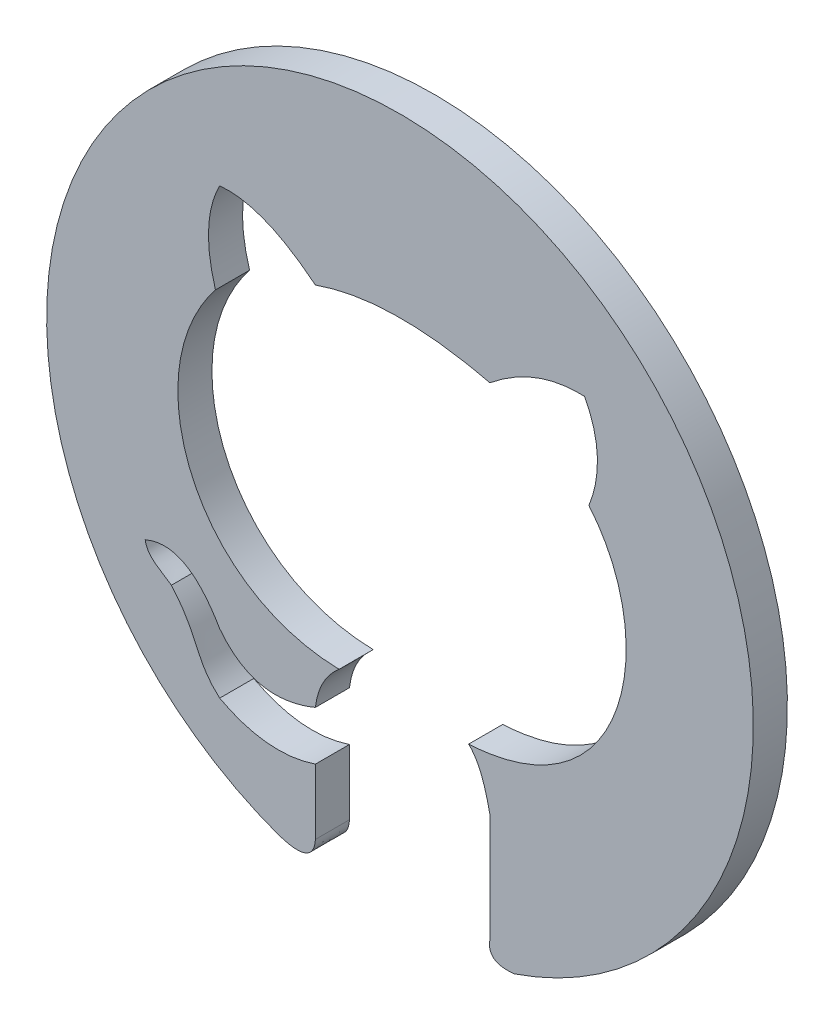
from build123d import *

# Parameters (mm, degrees)
RESSALTO_EXTRUS_O1_DEPTH = 10


with BuildPart() as part:
    # Esboço1 → Ressalto-extrusão1 (new body)
    with BuildSketch(Plane.XY):
        with BuildLine():
            Line((-7.232646643, -62.48429229), (-7.232646643, -94.533889528))
            add(Edge.make_bspline(
                [(0, -99.502819333), (-8.159285206, -100.402600429), (-7.232646643, -94.533889528)],
                knots=[0, 0, 0, 1, 1, 1], degree=2))
            ThreePointArc((0, -99.502819333), (-32.604573624, 102.237231854), (-69.037862067, -98.84663614))
            add(Edge.make_bspline(
                [(-69.037862067, -98.84663614), (-58.877940065, -102.146119369), (-58.412623628, -94.533889528)],
                knots=[0, 0, 0, 1, 1, 1], degree=2))
            Line((-58.412623628, -94.533889528), (-58.412623628, -75.403509781))
            add(Edge.make_bspline(
                [(-86.487077022, -72.670598389), (-72.514014981, -80.122898144), (-58.412623628, -75.403509781)],
                knots=[0, 0, 0, 1, 1, 1], degree=2))
            add(Edge.make_bspline(
                [(-100.648526965, -51.05575374), (-92.264568181, -60.681780492), (-93.93848024, -66.150620573), (-86.487077022, -72.670598389)],
                knots=[0, 0, 0, 0, 1, 1, 1, 1], degree=3))
            add(Edge.make_bspline(
                [(-108.350368162, -43.353912543), (-107.730240194, -46.867971027), (-104.99114076, -48.264073443), (-100.648526965, -51.05575374)],
                knots=[0, 0, 0, 0, 1, 1, 1, 1], degree=3))
            add(Edge.make_bspline(
                [(-86.487077022, -55.030897583), (-96.23915973, -38.074667842), (-108.350368162, -43.353912543)],
                knots=[0, 0, 0, 1, 1, 1], degree=2))
            add(Edge.make_bspline(
                [(-58.412623628, -60.993613349), (-76.239781836, -68.383433735), (-86.487077022, -55.030897583)],
                knots=[0, 0, 0, 1, 1, 1], degree=2))
            add(Edge.make_bspline(
                [(-51.456121902, -47.825949367), (-57.481841957, -52.926838867), (-58.412623628, -60.993613349)],
                knots=[0, 0, 0, 1, 1, 1], degree=2))
            add(Edge.make_bspline(
                [(-87.729309473, 30.434695052), (-112.261906541, -0.619225286), (-93.998220032, -46.894370576), (-51.456121902, -47.825949367)],
                knots=[0, 0, 0, 0, 1, 1, 1, 1], degree=3))
            add(Edge.make_bspline(
                [(-86.487077022, 57.515362486), (-92.384526984, 46.030854666), (-87.729309473, 30.434695052)],
                knots=[0, 0, 0, 1, 1, 1], degree=2))
            add(Edge.make_bspline(
                [(-58.412623628, 46.335270426), (-73.757926553, 58.757230824), (-86.487077022, 57.515362486)],
                knots=[0, 0, 0, 1, 1, 1], degree=2))
            add(Edge.make_bspline(
                [(-58.412623628, 46.335270426), (-36.364743942, 54.098608343), (-7.232646643, 47.080609896)],
                knots=[0, 0, 0, 1, 1, 1], degree=2))
            add(Edge.make_bspline(
                [(-7.232646643, 47.080609896), (6.307693164, 58.136478446), (20.593360262, 57.515362486)],
                knots=[0, 0, 0, 1, 1, 1], degree=2))
            add(Edge.make_bspline(
                [(20.593360262, 57.515362486), (27.4214118, 44.39924277), (21.835592713, 30.434695052)],
                knots=[0, 0, 0, 1, 1, 1], degree=2))
            add(Edge.make_bspline(
                [(21.835592713, 30.434695052), (43.574260816, 4.969398131), (33.44944429, -45.341538602), (-13.443808898, -47.825949367)],
                knots=[0, 0, 0, 0, 1, 1, 1, 1], degree=3))
            add(Edge.make_bspline(
                [(-13.443808898, -47.825949367), (-10.137665295, -50.925458995), (-8.474815726, -56.583989145), (-7.232646643, -62.48429229)],
                knots=[0, 0, 0, 0, 1, 1, 1, 1], degree=3))
        make_face()
    extrude(amount=RESSALTO_EXTRUS_O1_DEPTH)


solid = part.part
